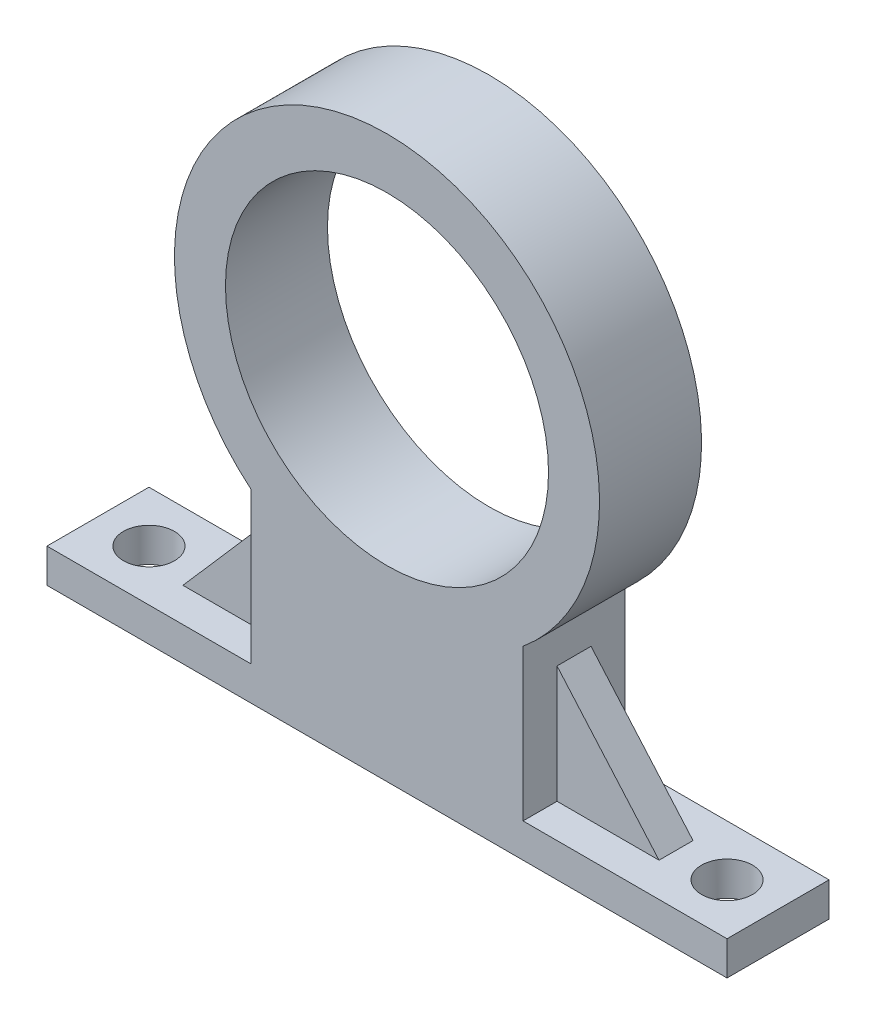
from build123d import *

# Parameters (mm, degrees)
SKETCH1_R                            = 12.5
SKETCH1_R_2                          = 9.5
BOSS_EXTRUDE1_DEPTH                  = 6
SKETCH2_W                            = 16
SKETCH2_H                            = 6
BOSS_EXTRUDE2_DEPTH                  = 8
BOSS_EXTRUDE2_DIRECTION_2_REACH      = 30.588
BOSS_EXTRUDE2_DIRECTION_2_END_RADIUS = 12.5
SKETCH3_W                            = 6
SKETCH3_H                            = 2
BOSS_EXTRUDE3_DEPTH                  = 12
BOSS_EXTRUDE4_DEPTH                  = 1
CUT_EXTRUDE1_REACH                   = 39.376
SKETCH7_R                            = 1.5


with BuildPart() as part:
    # Sketch1 → Boss-Extrude1 (new body)
    with BuildSketch(Plane.XY):
        Circle(SKETCH1_R)
        Circle(SKETCH1_R_2, mode=Mode.SUBTRACT)
    extrude(amount=BOSS_EXTRUDE1_DEPTH)

    # Sketch2 → Boss-Extrude2 (add)
    with BuildSketch(Plane(origin=(0, -12.5, 0), x_dir=(-1, 0, 0), z_dir=(0, -1, 0))):
        with Locations((0, -3)):
            Rectangle(SKETCH2_W, SKETCH2_H)
    extrude(amount=BOSS_EXTRUDE2_DEPTH)

    # Boss-Extrude2 direction 2: up to this cylinder (the profile starts outside it)
    boss_extrude2_direction_2_end = Plane(origin=(0, 0, 3), z_dir=(0, 0, -1)) * Cylinder(BOSS_EXTRUDE2_DIRECTION_2_END_RADIUS, 87.176, mode=Mode.PRIVATE)
    # Sketch2 → Boss-Extrude2 direction 2 (add, up to the surface)
    with BuildSketch(Plane(origin=(0, -12.5, 0), x_dir=(-1, 0, 0), z_dir=(0, -1, 0)), mode=Mode.PRIVATE) as boss_extrude2_direction_2_sk1:
        with Locations((0, -3)):
            Rectangle(SKETCH2_W, SKETCH2_H)
    boss_extrude2_direction_2_tool1 = extrude(boss_extrude2_direction_2_sk1.sketch, amount=-BOSS_EXTRUDE2_DIRECTION_2_REACH, mode=Mode.PRIVATE) - boss_extrude2_direction_2_end
    add(boss_extrude2_direction_2_tool1.solids().sort_by_distance((0, -12.5, 3))[0])
    add(boss_extrude2_direction_2_tool1.solids().sort_by_distance((0, -12.5, 3))[1])

    # Sketch3 → Boss-Extrude3 (add)
    with BuildSketch(Plane(origin=(8, 0, 0), x_dir=(0, 0, -1), z_dir=(1, 0, 0))):
        with Locations((-3, -19.5)):
            Rectangle(SKETCH3_W, SKETCH3_H)
    boss_extrude3 = extrude(amount=BOSS_EXTRUDE3_DEPTH)

    # Mirror1: Boss-Extrude3 across plane
    add(boss_extrude3.mirror(Plane(origin=(0, 0, 0), x_dir=(0, 0, 1), z_dir=(1, 0, 0))))

    # Sketch6 → Boss-Extrude4 (add, symmetric)
    with BuildSketch(Plane.XY.offset(3)):
        Polygon((14, -18.5), (8, -11.604686356), (8, -18.5), align=None)
    boss_extrude4 = extrude(amount=BOSS_EXTRUDE4_DEPTH, both=True)

    # Mirror2: Boss-Extrude4 across plane
    add(boss_extrude4.mirror(Plane(origin=(0, 0, 0), x_dir=(0, 0, 1), z_dir=(1, 0, 0))))

    # Sketch7 → Cut-Extrude1 (cut, up to next)
    with BuildSketch(Plane(origin=(0, -18.5, 0), x_dir=(1, 0, 0), z_dir=(0, 1, 0)), mode=Mode.PRIVATE) as cut_extrude1_sk1:
        with Locations(Location((-17, -3, 0), (0, 0, 270))):
            Circle(SKETCH7_R)
    cut_extrude1_tool1 = extrude(cut_extrude1_sk1.sketch, amount=-CUT_EXTRUDE1_REACH, mode=Mode.PRIVATE) & part.part
    # Sketch7 → Cut-Extrude1 (cut, up to next)
    with BuildSketch(Plane(origin=(0, -18.5, 0), x_dir=(1, 0, 0), z_dir=(0, 1, 0)), mode=Mode.PRIVATE) as cut_extrude1_sk2:
        with Locations(Location((17, -3, 0), (0, 0, 270))):
            Circle(SKETCH7_R)
    cut_extrude1_tool2 = extrude(cut_extrude1_sk2.sketch, amount=-CUT_EXTRUDE1_REACH, mode=Mode.PRIVATE) & part.part
    add(cut_extrude1_tool1.solids().sort_by_distance((-17, -18.5, 3))[0], mode=Mode.SUBTRACT)
    add(cut_extrude1_tool2.solids().sort_by_distance((17, -18.5, 3))[0], mode=Mode.SUBTRACT)


solid = part.part
